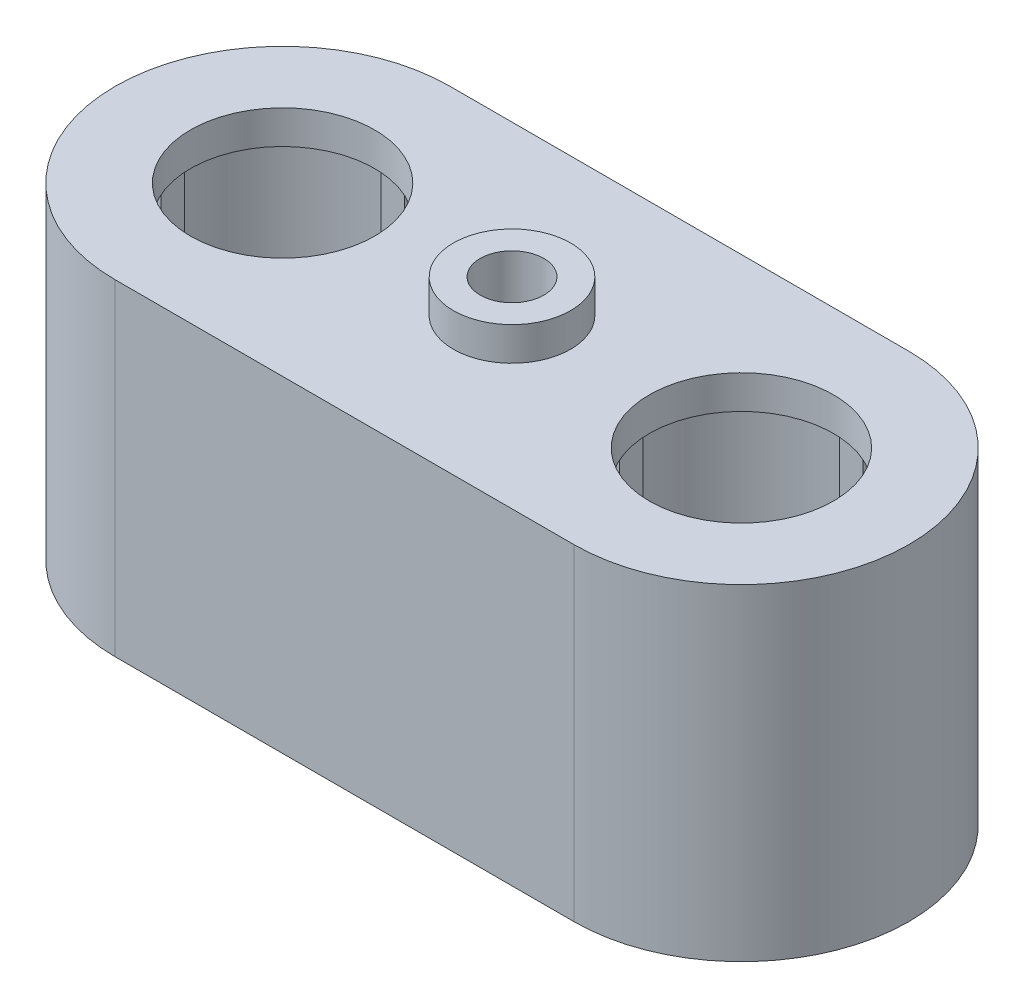
from build123d import *

# Parameters (mm, degrees)
SKETCH1_R           = 0.95
BOSS_EXTRUDE1_DEPTH = 2.5
SKETCH2_R           = 0.95
BOSS_EXTRUDE2_DEPTH = 9.75
BOSS_EXTRUDE3_START = -1
SKETCH3_R           = 0.95
SKETCH3_R_2         = 2.75
BOSS_EXTRUDE3_DEPTH = 1
SKETCH4_R           = 1.75
SKETCH4_R_2         = 0.95
BOSS_EXTRUDE4_DEPTH = 1


with BuildPart() as part:
    # Sketch1 → Boss-Extrude1 (new body)
    with BuildSketch(Plane(origin=(0, 0, 0), x_dir=(1, 0, 0), z_dir=(0, 1, 0))):
        with BuildLine():
            Line((6.85, 5), (2.25, 5))
            Line((2.25, 5), (-2.25, 5))
            Line((-2.25, 5), (-6.85, 5))
            ThreePointArc((-6.85, 5), (-1.85, 0), (-6.85, -5))
            Line((-6.85, -5), (-2.35, -5))
            Line((-2.35, -5), (2.35, -5))
            Line((2.35, -5), (6.85, -5))
            ThreePointArc((6.85, -5), (1.85, 0), (6.85, 5))
        make_face()
        with Locations(Location((0, 0, 0), (0, 0, 270))):
            Circle(SKETCH1_R, mode=Mode.SUBTRACT)
    extrude(amount=BOSS_EXTRUDE1_DEPTH)

    # Sketch2 → Boss-Extrude2 (add)
    with BuildSketch(Plane(origin=(0, 0, 0), x_dir=(1, 0, 0), z_dir=(0, 1, 0))):
        with BuildLine():
            Line((-6.85, 5), (6.85, 5))
            ThreePointArc((6.85, 5), (11.85, 0), (6.85, -5))
            Line((6.85, -5), (-6.85, -5))
            ThreePointArc((-6.85, -5), (-11.85, 0), (-6.85, 5))
        make_face()
        with Locations(Location((0, 0, 0), (0, 0, 270))):
            Circle(SKETCH2_R, mode=Mode.SUBTRACT)
        with BuildLine():
            Line((-7.2, 3.984658078), (-7.2, 3.284658078))
            Line((-7.2, 3.284658078), (-6.5, 3.284658078))
            Line((-6.5, 3.284658078), (-6.5, 3.984658078))
            ThreePointArc((-6.5, 3.984658078), (-4.021572875, 2.828427125), (-2.865341922, 0.35))
            Line((-2.865341922, 0.35), (-3.565341922, 0.35))
            Line((-3.565341922, 0.35), (-3.565341922, -0.35))
            Line((-3.565341922, -0.35), (-2.865341922, -0.35))
            ThreePointArc((-2.865341922, -0.35), (-4.021572875, -2.828427125), (-6.5, -3.984658078))
            Line((-6.5, -3.984658078), (-6.5, -3.284658078))
            Line((-6.5, -3.284658078), (-7.2, -3.284658078))
            Line((-7.2, -3.284658078), (-7.2, -3.984658078))
            ThreePointArc((-7.2, -3.984658078), (-9.678427125, -2.828427125), (-10.834658078, -0.35))
            Line((-10.834658078, -0.35), (-10.134658078, -0.35))
            Line((-10.134658078, -0.35), (-10.134658078, 0.35))
            Line((-10.134658078, 0.35), (-10.834658078, 0.35))
            ThreePointArc((-10.834658078, 0.35), (-9.678427125, 2.828427125), (-7.2, 3.984658078))
        make_face(mode=Mode.SUBTRACT)
        with BuildLine():
            Line((-3.85, 4), (3.85, 4))
            ThreePointArc((3.85, 4), (2.532477728, 2.521706056), (1.892153285, 0.647885752))
            ThreePointArc((1.892153285, 0.647885752), (0, 2), (-1.892153285, 0.647885752))
            ThreePointArc((-1.892153285, 0.647885752), (-2.532477728, 2.521706056), (-3.85, 4))
        make_face(mode=Mode.SUBTRACT)
        with BuildLine():
            Line((-3.85, -4), (3.85, -4))
            ThreePointArc((3.85, -4), (2.532477728, -2.521706056), (1.892153285, -0.647885752))
            ThreePointArc((1.892153285, -0.647885752), (0, -2), (-1.892153285, -0.647885752))
            ThreePointArc((-1.892153285, -0.647885752), (-2.532477728, -2.521706056), (-3.85, -4))
        make_face(mode=Mode.SUBTRACT)
        with BuildLine():
            Line((6.5, 3.984658078), (6.5, 3.284658078))
            Line((6.5, 3.284658078), (7.2, 3.284658078))
            Line((7.2, 3.284658078), (7.2, 3.984658078))
            ThreePointArc((7.2, 3.984658078), (9.678427125, 2.828427125), (10.834658078, 0.35))
            Line((10.834658078, 0.35), (10.134658078, 0.35))
            Line((10.134658078, 0.35), (10.134658078, -0.35))
            Line((10.134658078, -0.35), (10.834658078, -0.35))
            ThreePointArc((10.834658078, -0.35), (9.678427125, -2.828427125), (7.2, -3.984658078))
            Line((7.2, -3.984658078), (7.2, -3.284658078))
            Line((7.2, -3.284658078), (6.5, -3.284658078))
            Line((6.5, -3.284658078), (6.5, -3.984658078))
            ThreePointArc((6.5, -3.984658078), (4.021572875, -2.828427125), (2.865341922, -0.35))
            Line((2.865341922, -0.35), (3.565341922, -0.35))
            Line((3.565341922, -0.35), (3.565341922, 0.35))
            Line((3.565341922, 0.35), (2.865341922, 0.35))
            ThreePointArc((2.865341922, 0.35), (4.021572875, 2.828427125), (6.5, 3.984658078))
        make_face(mode=Mode.SUBTRACT)
    extrude(amount=BOSS_EXTRUDE2_DEPTH)

    # Sketch3 → Boss-Extrude3 (add)
    with BuildSketch(Plane(origin=(0, 9.75, 0), x_dir=(1, 0, 0), z_dir=(0, 1, 0)).offset(BOSS_EXTRUDE3_START)):
        with BuildLine():
            Line((-6.85, 5), (6.85, 5))
            ThreePointArc((6.85, 5), (11.85, 0), (6.85, -5))
            Line((6.85, -5), (-6.85, -5))
            ThreePointArc((-6.85, -5), (-11.85, 0), (-6.85, 5))
        make_face()
        with Locations(Location((0, 0, 0), (0, 0, 270))):
            Circle(SKETCH3_R, mode=Mode.SUBTRACT)
        with Locations(Location((-6.85, 0, 0), (0, 0, 270))):
            Circle(SKETCH3_R_2, mode=Mode.SUBTRACT)
        with Locations(Location((6.85, 0, 0), (0, 0, 270))):
            Circle(SKETCH3_R_2, mode=Mode.SUBTRACT)
    extrude(amount=BOSS_EXTRUDE3_DEPTH)

    # Sketch4 → Boss-Extrude4 (add)
    with BuildSketch(Plane(origin=(0, 9.75, 0), x_dir=(1, 0, 0), z_dir=(0, 1, 0))):
        with Locations(Location((0, 0, 0), (0, 0, 270))):
            Circle(SKETCH4_R)
        with Locations(Location((0, 0, 0), (0, 0, 270))):
            Circle(SKETCH4_R_2, mode=Mode.SUBTRACT)
    extrude(amount=BOSS_EXTRUDE4_DEPTH)


solid = part.part
